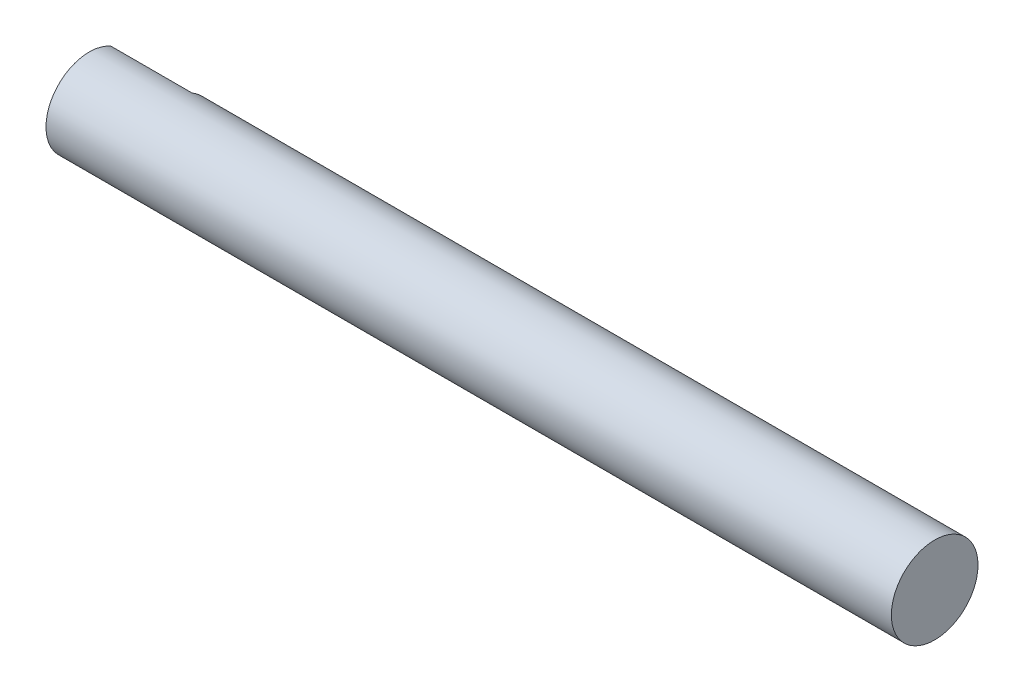
from build123d import *

# Parameters (mm, degrees)
BOSS_EXTRUDE1_DEPTH = 7.5
SKETCH2_R           = 3.995
BOSS_EXTRUDE2_DEPTH = 70.446


with BuildPart() as part:
    # Sketch1 → Boss-Extrude1 (new body)
    with BuildSketch(Plane(origin=(0, 0, 0), x_dir=(0, 0, -1), z_dir=(1, 0, 0))):
        with BuildLine():
            Line((1.985, 3.466958321), (1.985, -3.466958321))
            ThreePointArc((1.985, -3.466958321), (-3.995, 0), (1.985, 3.466958321))
        make_face()
    extrude(amount=BOSS_EXTRUDE1_DEPTH)

    # Sketch2 → Boss-Extrude2 (add)
    with BuildSketch(Plane(origin=(7.5, 0, 0), x_dir=(0, 0, -1), z_dir=(1, 0, 0))):
        with Locations(Location((0, 0, 0), (0, 0, 299.79320791))):
            Circle(SKETCH2_R)
    extrude(amount=BOSS_EXTRUDE2_DEPTH)


solid = part.part
